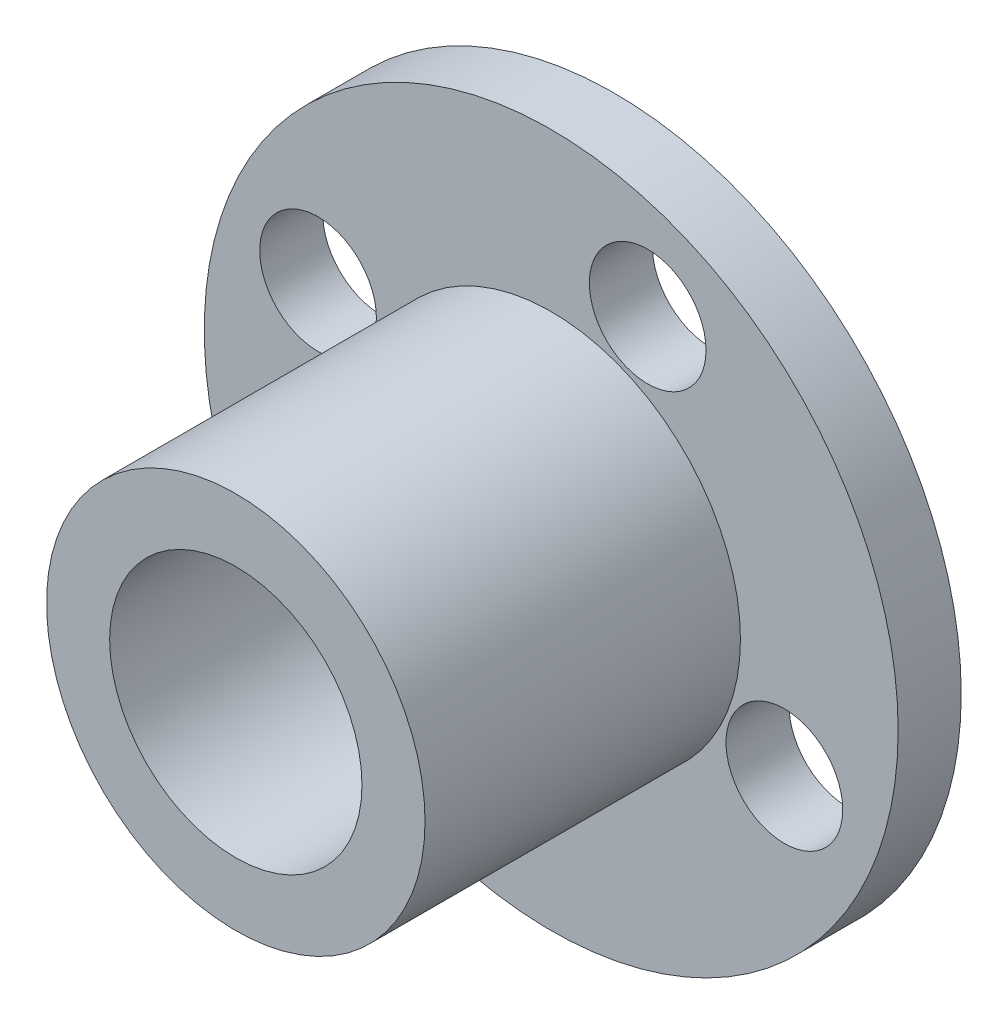
from build123d import *

# Parameters (mm, degrees)
SKETCH1_R           = 11
SKETCH1_R_2         = 1.85
BOSS_EXTRUDE1_DEPTH = 2
SKETCH2_R           = 6
BOSS_EXTRUDE2_DEPTH = 10
SKETCH4_R           = 4
CUT_EXTRUDE1_DEPTH  = 15


with BuildPart() as part:
    # Sketch1 → Boss-Extrude1 (new body)
    with BuildSketch(Plane(origin=(0, 0, 0), x_dir=(0, 1, 0), z_dir=(0, 0, 1))):
        with Locations(Location((0, 0, 0), (0, 0, 270))):
            Circle(SKETCH1_R)
        with Locations(Location((-7.392247164, 3.058542441, 0), (0, 0, 270))):
            Circle(SKETCH1_R_2, mode=Mode.SUBTRACT)
        with Locations(Location((3.058542441, 7.392247164, 0), (0, 0, 270))):
            Circle(SKETCH1_R_2, mode=Mode.SUBTRACT)
        with Locations(Location((7.392247164, -3.058542441, 0), (0, 0, 270))):
            Circle(SKETCH1_R_2, mode=Mode.SUBTRACT)
        with Locations(Location((-3.058542441, -7.392247164, 0), (0, 0, 270))):
            Circle(SKETCH1_R_2, mode=Mode.SUBTRACT)
    extrude(amount=BOSS_EXTRUDE1_DEPTH)

    # Sketch2 → Boss-Extrude2 (add)
    with BuildSketch(Plane.XY.offset(2)):
        Circle(SKETCH2_R)
    extrude(amount=BOSS_EXTRUDE2_DEPTH)

    # Sketch4 → Cut-Extrude1 (cut)
    with BuildSketch(Plane(origin=(0, 0, 0), x_dir=(1, 0, 0), z_dir=(0, 0, -1))):
        with Locations(Location((0, 0, 0), (0, 0, 180))):
            Circle(SKETCH4_R)
    extrude(amount=-CUT_EXTRUDE1_DEPTH, mode=Mode.SUBTRACT)


solid = part.part
